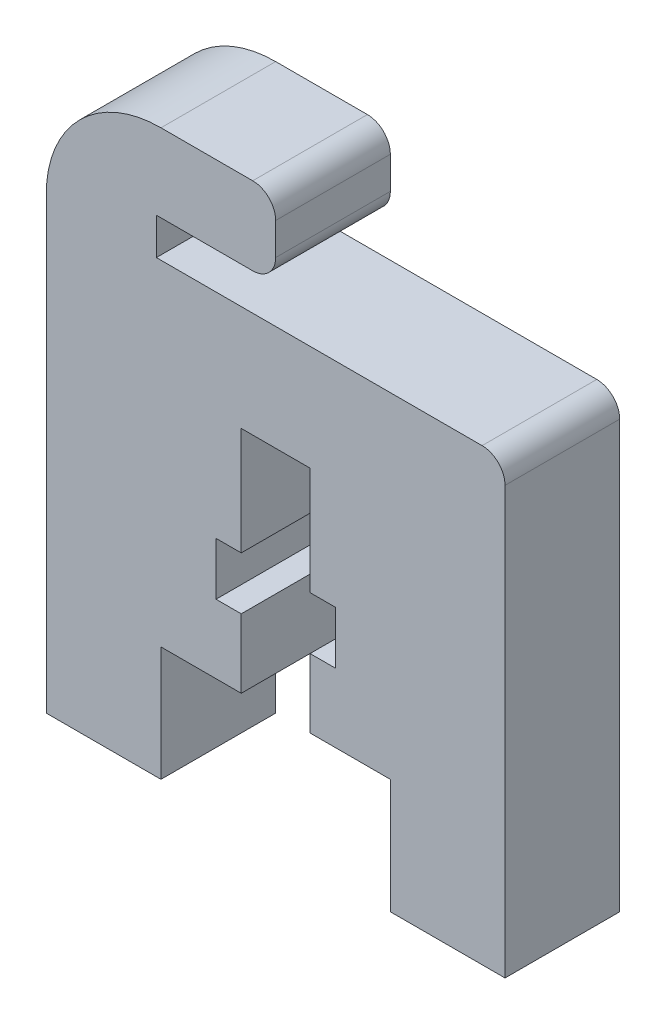
from build123d import *

# Parameters (mm, degrees)
BOSS_EXTRUDE1_DEPTH = 5
FILLET1_R           = 5
FILLET3_R           = 1
FILLET4_R           = 1


with BuildPart() as part:
    # Sketch1 → Boss-Extrude1 (new body)
    with BuildSketch(Plane.XY):
        Polygon((0, 5), (0, 19.982808697), (0, 24.6), (10, 24.6), (10, 21.2), (4.8, 21.2), (4.8, 19.6), (20, 19.6), (20, 5), (20, 0), (15, 0), (15, 5), (11.5, 5), (11.5, 8), (12.6, 8), (12.6, 10.3), (11.5, 10.3), (11.5, 15), (8.5, 15), (8.5, 10.3), (7.4, 10.3), (7.4, 8), (8.5, 8), (8.5, 5), (5, 5), (5, 0), (0, 0), align=None)
    extrude(amount=BOSS_EXTRUDE1_DEPTH)

    # Fillet1
    fillet1_edges = [part.edges().sort_by_distance(p)[0] for p in [
        (0, 24.6, 2.5),
    ]]
    fillet(fillet1_edges, radius=FILLET1_R)

    # Fillet3
    fillet3_edges = [part.edges().sort_by_distance(p)[0] for p in [
        (10, 21.2, 2.5),
        (20, 19.6, 2.5),
    ]]
    fillet(fillet3_edges, radius=FILLET3_R)

    # Fillet4
    fillet4_edges = [part.edges().sort_by_distance(p)[0] for p in [
        (10, 24.6, 2.5),
    ]]
    fillet(fillet4_edges, radius=FILLET4_R)


solid = part.part
